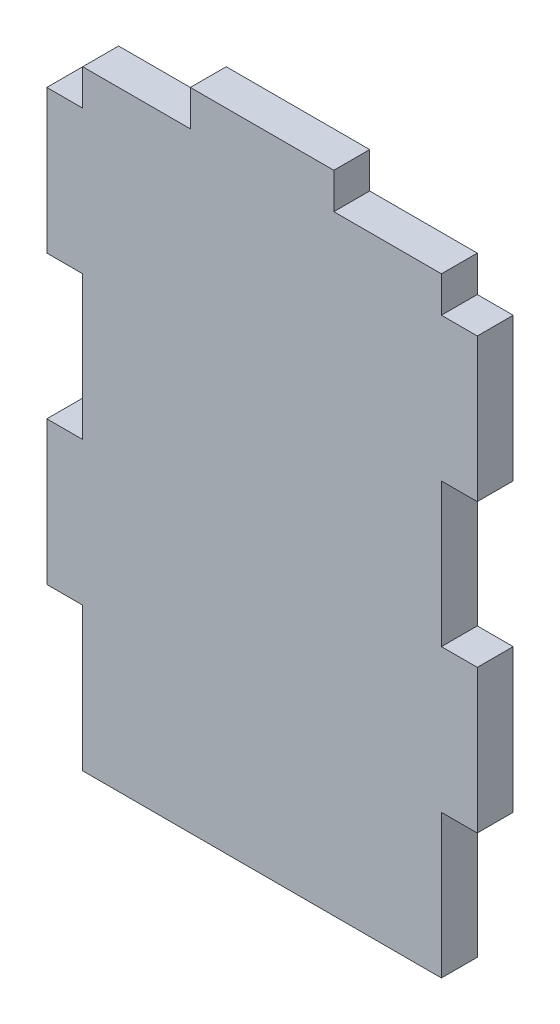
from build123d import *

# Parameters (mm, degrees)
SKETCH_1_W               = 50
SKETCH_1_H               = 85
EXTRUDE_1_DEPTH          = 5
SKETCH_2_W               = 5
SKETCH_2_H               = 20
EXTRUDE_2_DEPTH          = 5
PATTERN_LINEAR_1_COUNT   = 2
PATTERN_LINEAR_1_PITCH   = 40
MIRROR_1_COPY_1_SKETCH_W = 5
MIRROR_1_COPY_1_SKETCH_H = 20
MIRROR_1_COPY_1_DEPTH    = 5
SKETCH_4_W               = 20
SKETCH_4_H               = 5
EXTRUDE_3_DEPTH          = 5


with BuildPart() as part:
    # 스케치1 → 보스-돌출1 (new body)
    with BuildSketch(Plane.XY):
        Rectangle(SKETCH_1_W, SKETCH_1_H)
    extrude(amount=EXTRUDE_1_DEPTH)

    # 스케치2 → 보스-돌출2 (add)
    with BuildSketch(Plane.XY.offset(5)):
        with Locations((-27.5, -12.5)):
            Rectangle(SKETCH_2_W, SKETCH_2_H)
    extrude_2 = extrude(amount=-EXTRUDE_2_DEPTH)

    # 선형 패턴1: 보스-돌출2 ×2
    with Locations(*[(0, i * PATTERN_LINEAR_1_PITCH, 0) for i in range(1, PATTERN_LINEAR_1_COUNT)]):
        add(extrude_2)

    # 대칭 복사1: 보스-돌출2 across plane
    add(extrude_2.mirror(Plane(origin=(0, 0, 0), x_dir=(0, 0, 1), z_dir=(1, 0, 0))))

    # 대칭 복사1 copy 1 sketch → 대칭 복사1 copy 1 (add)
    with BuildSketch(Plane(origin=(0, 40, 5), x_dir=(-1, 0, 0), z_dir=(0, 0, 1))):
        with Locations((-27.5, 12.5)):
            Rectangle(MIRROR_1_COPY_1_SKETCH_W, MIRROR_1_COPY_1_SKETCH_H)
    extrude(amount=-MIRROR_1_COPY_1_DEPTH)

    # 스케치4 → 보스-돌출3 (add)
    with BuildSketch(Plane.XY.offset(5)):
        with Locations((0, 45)):
            Rectangle(SKETCH_4_W, SKETCH_4_H)
    extrude(amount=-EXTRUDE_3_DEPTH)


solid = part.part
